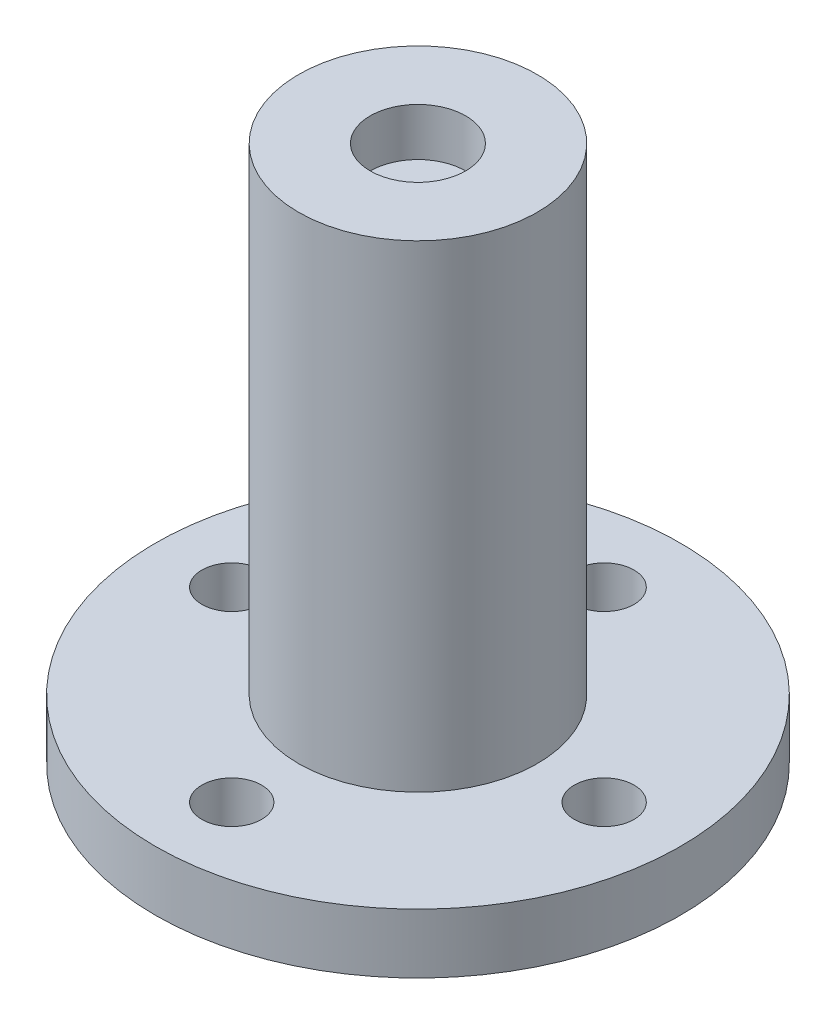
from build123d import *

# Parameters (mm, degrees)
SKETCH1_R           = 11
SKETCH1_R_2         = 1.25
BOSS_EXTRUDE2_DEPTH = 2.5
SKETCH2_R           = 5
BOSS_EXTRUDE3_DEPTH = 18
SKETCH3_R           = 5
SKETCH3_R_2         = 2
BOSS_EXTRUDE4_DEPTH = 2


with BuildPart() as part:
    # Sketch1 → Boss-Extrude2 (new body)
    with BuildSketch(Plane(origin=(0, 0, 0), x_dir=(1, 0, 0), z_dir=(0, 1, 0))):
        with Locations(Location((0, 0, 0), (0, 0, 270))):
            Circle(SKETCH1_R)
        with Locations(Location((-7.8, 0, 0), (0, 0, 270))):
            Circle(SKETCH1_R_2, mode=Mode.SUBTRACT)
        with Locations(Location((0, 7.8, 0), (0, 0, 270))):
            Circle(SKETCH1_R_2, mode=Mode.SUBTRACT)
        with Locations(Location((7.8, 0, 0), (0, 0, 270))):
            Circle(SKETCH1_R_2, mode=Mode.SUBTRACT)
        with Locations(Location((0, -7.8, 0), (0, 0, 270))):
            Circle(SKETCH1_R_2, mode=Mode.SUBTRACT)
    extrude(amount=BOSS_EXTRUDE2_DEPTH)

    # Sketch2 → Boss-Extrude3 (add)
    with BuildSketch(Plane(origin=(0, 2.5, 0), x_dir=(1, 0, 0), z_dir=(0, 1, 0))):
        with Locations(Location((0, 0, 0), (0, 0, 270))):
            Circle(SKETCH2_R)
    extrude(amount=BOSS_EXTRUDE3_DEPTH)

    # Sketch3 → Boss-Extrude4 (add)
    with BuildSketch(Plane(origin=(0, 20.5, 0), x_dir=(1, 0, 0), z_dir=(0, 1, 0))):
        with Locations(Location((0, 0, 0), (0, 0, 270))):
            Circle(SKETCH3_R)
        with Locations(Location((0, 0, 0), (0, 0, 270))):
            Circle(SKETCH3_R_2, mode=Mode.SUBTRACT)
    extrude(amount=BOSS_EXTRUDE4_DEPTH)


solid = part.part
